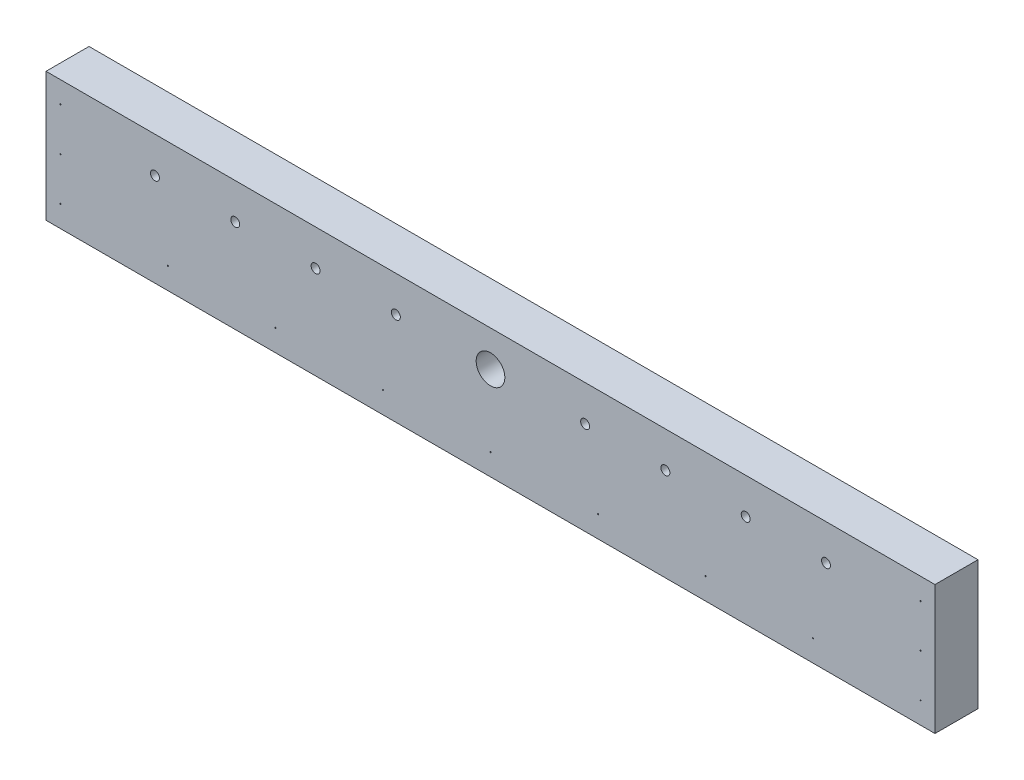
from build123d import *

# Parameters (mm, degrees)
SKETCH1_W           = 1574.8
SKETCH1_H           = 228.6
BOSS_EXTRUDE1_DEPTH = 76.2
SKETCH2_R           = 7.9375
CUT_EXTRUDE1_DEPTH  = 1594.128820906
SKETCH3_R           = 0.9921875
SKETCH3_R_2         = 1.016
CUT_EXTRUDE2_DEPTH  = 76.2
SKETCH4_R           = 25.4
CUT_EXTRUDE3_DEPTH  = 1594.128820906


with BuildPart() as part:
    # Sketch1 → Boss-Extrude1 (new body)
    with BuildSketch(Plane.XY):
        with Locations((787.4, 114.3)):
            Rectangle(SKETCH1_W, SKETCH1_H)
    extrude(amount=BOSS_EXTRUDE1_DEPTH)

    # Sketch2 → Cut-Extrude1 (cut, through all)
    with BuildSketch(Plane.XY.offset(76.2)):
        with Locations((193.04, 165.1)):
            Circle(SKETCH2_R)
        with Locations((335.28, 165.1)):
            Circle(SKETCH2_R)
        with Locations((477.52, 165.1)):
            Circle(SKETCH2_R)
        with Locations((619.76, 165.1)):
            Circle(SKETCH2_R)
        with Locations((955.04, 165.1)):
            Circle(SKETCH2_R)
        with Locations((1097.28, 165.1)):
            Circle(SKETCH2_R)
        with Locations((1239.52, 165.1)):
            Circle(SKETCH2_R)
        with Locations((1381.76, 165.1)):
            Circle(SKETCH2_R)
    extrude(amount=-CUT_EXTRUDE1_DEPTH, mode=Mode.SUBTRACT)

    # Sketch3 → Cut-Extrude2 (cut)
    with BuildSketch(Plane.XY.offset(76.2)):
        with Locations((1549.4, 38.1)):
            Circle(SKETCH3_R)
        with Locations((1549.4, 190.5)):
            Circle(SKETCH3_R_2)
        with Locations((1549.4, 114.3)):
            Circle(SKETCH3_R_2)
        with Locations((25.4, 38.1)):
            Circle(SKETCH3_R)
        with Locations((25.4, 114.3)):
            Circle(SKETCH3_R_2)
        with Locations((25.4, 190.5)):
            Circle(SKETCH3_R_2)
        with Locations((215.9, 38.1)):
            Circle(SKETCH3_R_2)
        with Locations((406.4, 38.1)):
            Circle(SKETCH3_R_2)
        with Locations((596.9, 38.1)):
            Circle(SKETCH3_R_2)
        with Locations((787.4, 38.1)):
            Circle(SKETCH3_R_2)
        with Locations((977.9, 38.1)):
            Circle(SKETCH3_R_2)
        with Locations((1168.4, 38.1)):
            Circle(SKETCH3_R_2)
        with Locations((1358.9, 38.1)):
            Circle(SKETCH3_R_2)
    extrude(amount=-CUT_EXTRUDE2_DEPTH, mode=Mode.SUBTRACT)

    # Sketch4 → Cut-Extrude3 (cut, through all)
    with BuildSketch(Plane.XY.offset(76.2)):
        with Locations((787.4, 165.1)):
            Circle(SKETCH4_R)
    extrude(amount=-CUT_EXTRUDE3_DEPTH, mode=Mode.SUBTRACT)


solid = part.part
